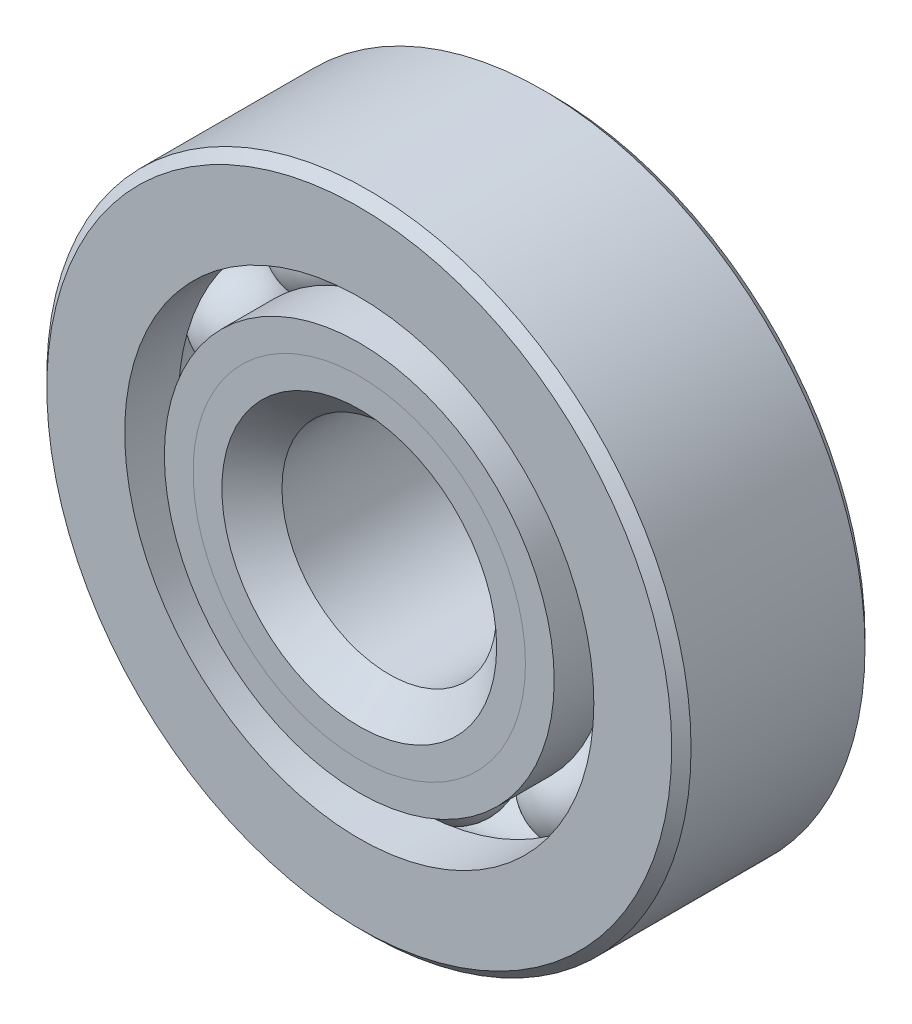
from build123d import *

# Parameters (mm, degrees)
CIRPATTERN1_COUNT = 10


with BuildPart() as part:
    # Sketch1 → Revolve1 (revolve)
    with BuildSketch(Plane(origin=(0, 0, 0), x_dir=(0, 0, -1), z_dir=(1, 0, 0))):
        with BuildLine():
            Line((4.05, 15), (-4.05, 15))
            Line((-4.05, 15), (-4.5, 14.55))
            Line((-4.5, 14.55), (-4.5, 10.923076923))
            Line((-4.5, 10.923076923), (-2, 10.923076923))
            ThreePointArc((-2, 10.923076923), (0, 12.202741702), (2, 10.923076923))
            Line((2, 10.923076923), (4.5, 10.923076923))
            Line((4.5, 10.923076923), (4.5, 14.55))
            Line((4.5, 14.55), (4.05, 15))
        make_face()
    revolve(axis=Axis((0, 0, 4.5), (0, 0, -1)))


with BuildPart() as body_2:
    # Sketch2 → Revolve2 (revolve)
    with BuildSketch(Plane(origin=(0, 0, 0), x_dir=(0, 0, -1), z_dir=(1, 0, 0))):
        with BuildLine():
            Line((-4.5, 9.076923077), (-2, 9.076923077))
            ThreePointArc((-2, 9.076923077), (-1.187175424, 8.144552475), (0, 7.797258298))
            Line((0, 7.797258298), (0, 6.398629149))
            Line((0, 6.398629149), (-3.160853036, 6.398629149))
            Line((-3.160853036, 6.398629149), (-4.5, 7.737776113))
            Line((-4.5, 7.737776113), (-4.5, 9.076923077))
        make_face()
    revolve(axis=Axis((0, 0, 4.5), (0, 0, -1)))


with BuildPart() as body_3:
    # Sketch3 → Revolve3 (revolve)
    with BuildSketch(Plane(origin=(0, 0, 0), x_dir=(0, 0, -1), z_dir=(1, 0, 0))):
        with BuildLine():
            Line((-4.5, 7.737776113), (-3.160853036, 6.398629149))
            Line((-3.160853036, 6.398629149), (0, 6.398629149))
            Line((0, 6.398629149), (0, 7.797258298))
            ThreePointArc((0, 7.797258298), (1.187175424, 8.144552475), (2, 9.076923077))
            Line((2, 9.076923077), (4.5, 9.076923077))
            Line((4.5, 9.076923077), (4.5, 5.45))
            Line((4.5, 5.45), (4.05, 5))
            Line((4.05, 5), (-3.101370851, 5))
            Line((-3.101370851, 5), (-4.5, 6.398629149))
            Line((-4.5, 6.398629149), (-4.5, 7.737776113))
        make_face()
    revolve(axis=Axis((0, 0, 4.5), (0, 0, -1)))


with BuildPart() as body_4:
    # Sketch4 → Revolve4 (revolve)
    with BuildSketch(Plane(origin=(0, 0, 0), x_dir=(0, 0, -1), z_dir=(1, 0, 0))):
        with BuildLine():
            Line((-2.202741702, 10), (2.202741702, 10))
            ThreePointArc((2.202741702, 10), (0, 12.202741702), (-2.202741702, 10))
        make_face()
    revolve(axis=Axis((0, 10, 2.202741702), (0, 0, -1)))


with BuildPart() as cirpattern1_1:
    # CirPattern1: pattern copy
    add(body_4.part.rotate(Axis((0, 0, -4.5), (0, 0, 1)), 1 * 360 / CIRPATTERN1_COUNT))


with BuildPart() as cirpattern1_2:
    # CirPattern1: pattern copy
    add(body_4.part.rotate(Axis((0, 0, -4.5), (0, 0, 1)), 2 * 360 / CIRPATTERN1_COUNT))


with BuildPart() as cirpattern1_3:
    # CirPattern1: pattern copy
    add(body_4.part.rotate(Axis((0, 0, -4.5), (0, 0, 1)), 3 * 360 / CIRPATTERN1_COUNT))


with BuildPart() as cirpattern1_4:
    # CirPattern1: pattern copy
    add(body_4.part.rotate(Axis((0, 0, -4.5), (0, 0, 1)), 4 * 360 / CIRPATTERN1_COUNT))


with BuildPart() as cirpattern1_5:
    # CirPattern1: pattern copy
    add(body_4.part.rotate(Axis((0, 0, -4.5), (0, 0, 1)), 5 * 360 / CIRPATTERN1_COUNT))


with BuildPart() as cirpattern1_6:
    # CirPattern1: pattern copy
    add(body_4.part.rotate(Axis((0, 0, -4.5), (0, 0, 1)), 6 * 360 / CIRPATTERN1_COUNT))


with BuildPart() as cirpattern1_7:
    # CirPattern1: pattern copy
    add(body_4.part.rotate(Axis((0, 0, -4.5), (0, 0, 1)), 7 * 360 / CIRPATTERN1_COUNT))


with BuildPart() as cirpattern1_8:
    # CirPattern1: pattern copy
    add(body_4.part.rotate(Axis((0, 0, -4.5), (0, 0, 1)), 8 * 360 / CIRPATTERN1_COUNT))


with BuildPart() as cirpattern1_9:
    # CirPattern1: pattern copy
    add(body_4.part.rotate(Axis((0, 0, -4.5), (0, 0, 1)), 9 * 360 / CIRPATTERN1_COUNT))


solid = Compound([part.part, body_2.part, body_3.part, body_4.part, cirpattern1_1.part, cirpattern1_2.part, cirpattern1_3.part, cirpattern1_4.part, cirpattern1_5.part, cirpattern1_6.part, cirpattern1_7.part, cirpattern1_8.part, cirpattern1_9.part])
